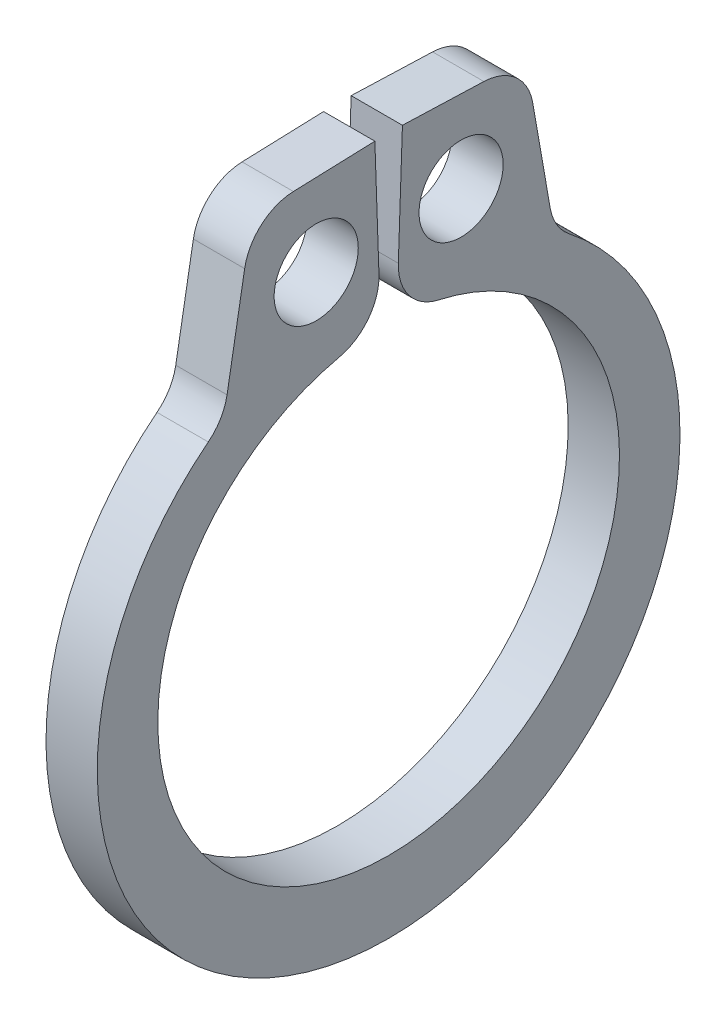
from build123d import *

# Parameters (mm, degrees)
BOSS_EXTRUDE1_DEPTH      = 0.3175
BOSS_EXTRUDE1_DEPTH_BACK = 0.3175
SKETCH3_R                = 0.5207
FILLET1_R                = 0.635


with BuildPart() as part:
    # Sketch3 → Boss-Extrude1 (new, two sides: drawn at the far end of the back side and taken through both)
    with BuildSketch(Plane(origin=(0, 0, 0), x_dir=(0, 0, -1), z_dir=(1, 0, 0)).offset(-BOSS_EXTRUDE1_DEPTH_BACK)):
        with BuildLine():
            Line((-1.69371271, 4.833334616), (-2.044154836, 2.83178164))
            ThreePointArc((-2.044154836, 2.83178164), (0, -3.7465), (2.044154836, 2.83178164))
            Line((2.044154836, 2.83178164), (1.69371271, 4.833334616))
            Line((1.69371271, 4.833334616), (0.170641089, 4.886521449))
            Line((0.170641089, 4.886521449), (0.099725312, 2.855759288))
            ThreePointArc((0.099725312, 2.855759288), (0, -2.8575), (-0.099725312, 2.855759288))
            Line((-0.099725312, 2.855759288), (-0.170641089, 4.886521449))
            Line((-0.170641089, 4.886521449), (-1.69371271, 4.833334616))
        make_face()
        with Locations((-0.896719011, 3.844546952)):
            Circle(SKETCH3_R, mode=Mode.SUBTRACT)
        with Locations((0.896719011, 3.844546952)):
            Circle(SKETCH3_R, mode=Mode.SUBTRACT)
    extrude(amount=BOSS_EXTRUDE1_DEPTH + BOSS_EXTRUDE1_DEPTH_BACK)

    # Fillet1
    fillet1_edges = [part.edges().sort_by_distance(p)[0] for p in [
        (0, 2.83178164, 2.044154836),
        (0, 4.833334616, 1.69371271),
        (0, 2.855759288, 0.099725312),
        (0, 2.855759288, -0.099725312),
        (0, 4.833334616, -1.69371271),
        (0, 2.83178164, -2.044154836),
    ]]
    fillet(fillet1_edges, radius=FILLET1_R)


solid = part.part
